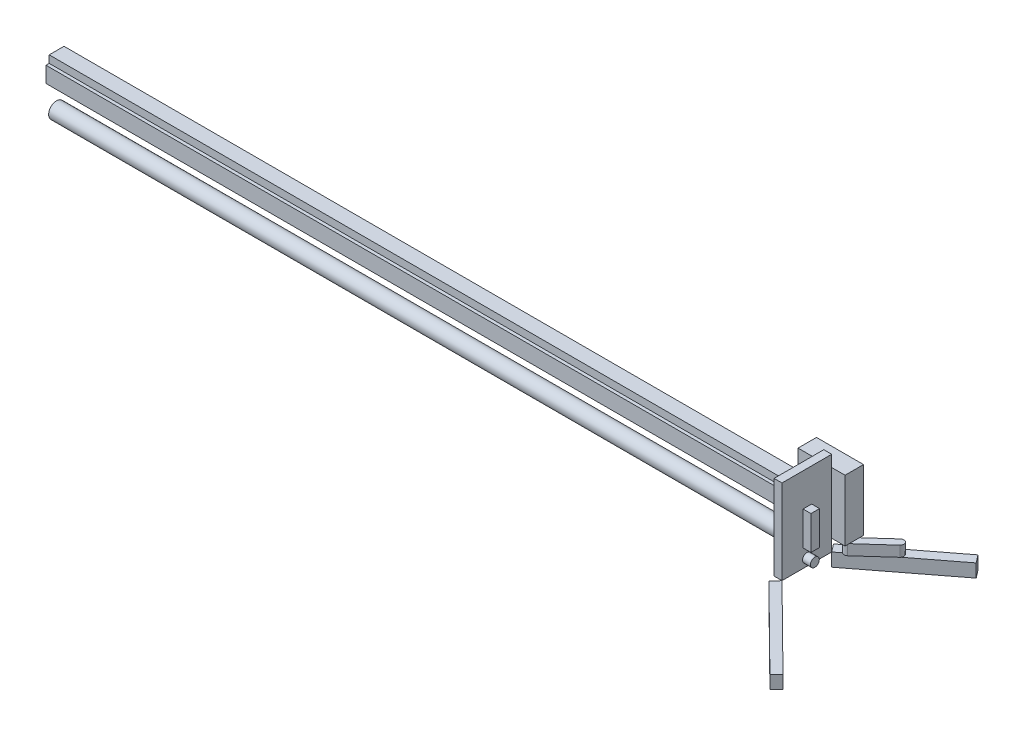
from build123d import *

# Parameters (mm, degrees)
SKETCH2_R             = 3
BOSS_EXTRUDE1_DEPTH   = 282
BOSS_EXTRUDE1_2_DEPTH = 282
SKETCH3_W             = 18.85204283
SKETCH3_H             = 32.098048838
BOSS_EXTRUDE2_DEPTH   = 3
BOSS_EXTRUDE3_DEPTH   = 5
BOSS_EXTRUDE3_2_DEPTH = 5
SKETCH5_W             = 17.836431683
SKETCH5_H             = 23.2602474
BOSS_EXTRUDE4_DEPTH   = 7
BOSS_EXTRUDE5_DEPTH   = 4
SKETCH7_R             = 1.678913889
SKETCH7_W             = 3.263600104
SKETCH7_H             = 12.793858283
BOSS_EXTRUDE6_DEPTH   = 3


with BuildPart() as part:
    # Sketch2 → Boss-Extrude1 (new body)
    with BuildSketch(Plane.ZY):
        with Locations((-15.87058853, 7.198699216)):
            Circle(SKETCH2_R)
    extrude(amount=-BOSS_EXTRUDE1_DEPTH)



with BuildPart() as body_2:
    # Sketch2 → Boss-Extrude1 2 (new body)
    with BuildSketch(Plane.ZY):
        Polygon((-19.87058853, 17.881027255), (-11.87058853, 17.881027255), (-11.87058853, 23.881027255), (-13.086657096, 23.881027255), (-13.086657096, 26.684981869), (-18.703311227, 26.684981869), (-18.703311227, 23.881027255), (-19.87058853, 23.881027255), align=None)
    extrude(amount=-BOSS_EXTRUDE1_2_DEPTH)


with BuildPart() as part_1:
    add(part.part)

    add(body_2.part)  # Boss-Extrude2 merges body 2
    # Sketch3 → Boss-Extrude2 (add)
    with BuildSketch(Plane(origin=(282, 0, 0), x_dir=(0, 0, -1), z_dir=(1, 0, 0))):
        with Locations((15.442133011, 16.049024419)):
            Rectangle(SKETCH3_W, SKETCH3_H)
    extrude(amount=BOSS_EXTRUDE2_DEPTH)

    # Sketch5 → Boss-Extrude4 (add)
    with BuildSketch(Plane(origin=(0, 0, -24.868154426), x_dir=(-1, 0, 0), z_dir=(0, 0, -1))):
        with Locations((-281.152419038, 16.118209998)):
            Rectangle(SKETCH5_W, SKETCH5_H)
    extrude(amount=BOSS_EXTRUDE4_DEPTH)

    # Sketch6 → Boss-Extrude5 (add)
    with BuildSketch(Plane.XZ.offset(-4.488086298)):
        with BuildLine():
            Line((289.755481647, -26.15198938), (300.152156309, -35.533967686))
            ThreePointArc((300.152156309, -35.533967686), (300.256943196, -37.576493481), (298.214417401, -37.681280369))
            Line((298.214417401, -37.681280369), (287.817742739, -28.299302063))
            ThreePointArc((287.817742739, -28.299302063), (287.712955852, -26.256776267), (289.755481647, -26.15198938))
        make_face()
    extrude(amount=BOSS_EXTRUDE5_DEPTH)

    # Sketch7 → Boss-Extrude6 (add)
    with BuildSketch(Plane(origin=(285, 0, 0), x_dir=(0, 0, -1), z_dir=(1, 0, 0))):
        with Locations((15.480360711, 2.823096133)):
            Circle(SKETCH7_R)
        with Locations((15.636124716, 13.151660915)):
            Rectangle(SKETCH7_W, SKETCH7_H)
    extrude(amount=BOSS_EXTRUDE6_DEPTH)


with BuildPart() as body_2_2:
    # Sketch4 → Boss-Extrude3 (new body)
    with BuildSketch(Plane.XZ):
        Polygon((285, -24.868154426), (315.993567271, -48.671964131), (313.696349111, -51.663039361), (282.70278184, -27.859229656), align=None)
    extrude(amount=BOSS_EXTRUDE3_DEPTH)


with BuildPart() as body_3:
    # Sketch4 → Boss-Extrude3 2 (new body)
    with BuildSketch(Plane.XZ):
        Polygon((285, -6.016111596), (315.993567271, 24.594647062), (313.52845125, 27.090591056), (282.70278184, -3.354343486), align=None)
    extrude(amount=BOSS_EXTRUDE3_2_DEPTH)


solid = Compound([part_1.part, body_2_2.part, body_3.part])
